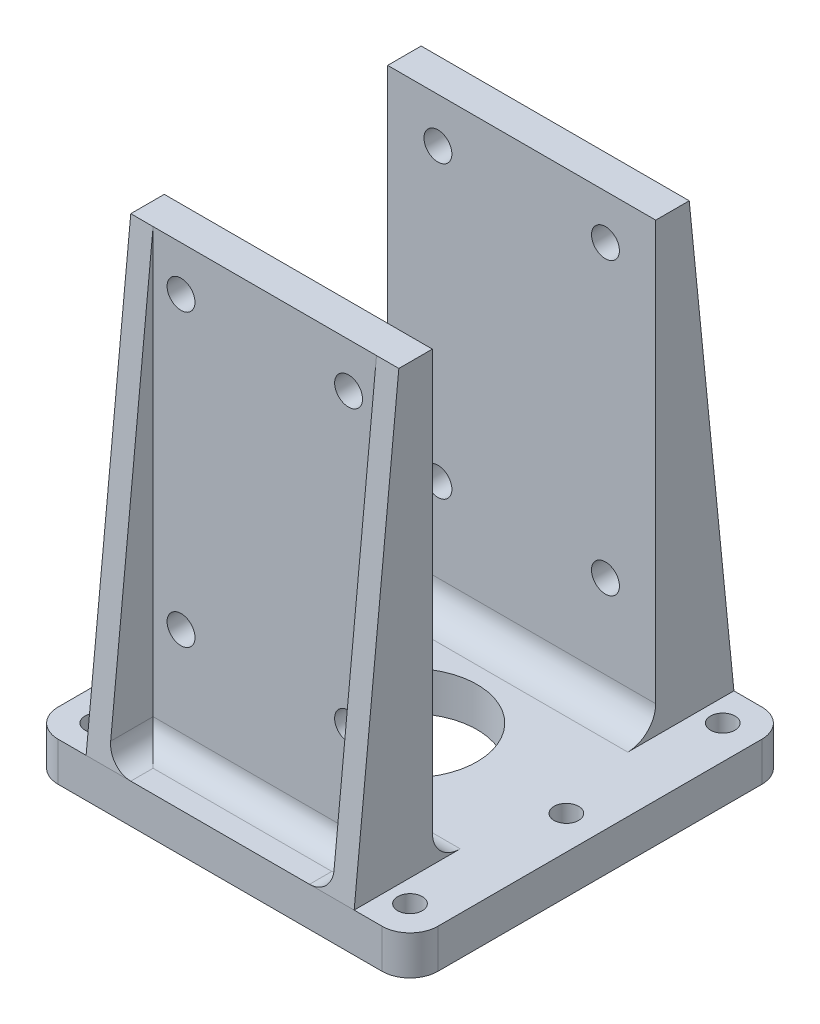
from build123d import *

# Parameters (mm, degrees)
SKETCH1_R           = 2.2
SKETCH1_R_2         = 12
BOSS_EXTRUDE1_DEPTH = 7
SKETCH2_W           = 48
SKETCH2_H           = 6
BOSS_EXTRUDE2_DEPTH = 80
BOSS_EXTRUDE3_DEPTH = 48
SKETCH5_W           = 40
SKETCH5_H           = 8
CUT_EXTRUDE1_DEPTH  = 80
SKETCH6_R           = 2.5
CUT_EXTRUDE2_DEPTH  = 80
FILLET1_R           = 5
FILLET5_R           = 4


with BuildPart() as part:
    # Sketch1 → Boss-Extrude1 (new body)
    with BuildSketch(Plane(origin=(0, 0, 0), x_dir=(1, 0, 0), z_dir=(0, 1, 0))):
        with BuildLine():
            Line((5, 0), (63, 0))
            ThreePointArc((63, 0), (66.535533906, 1.464466094), (68, 5))
            Line((68, 5), (68, 63))
            ThreePointArc((68, 63), (66.535533906, 66.535533906), (63, 68))
            Line((63, 68), (5, 68))
            ThreePointArc((5, 68), (1.464466094, 66.535533906), (0, 63))
            Line((0, 63), (0, 5))
            ThreePointArc((0, 5), (1.464466094, 1.464466094), (5, 0))
        make_face()
        with Locations(Location((6, 6, 0), (0, 0, 270))):
            Circle(SKETCH1_R, mode=Mode.SUBTRACT)
        with Locations(Location((62, 6, 0), (0, 0, 270))):
            Circle(SKETCH1_R, mode=Mode.SUBTRACT)
        with Locations(Location((62, 34, 0), (0, 0, 270))):
            Circle(SKETCH1_R, mode=Mode.SUBTRACT)
        with Locations(Location((62, 62, 0), (0, 0, 270))):
            Circle(SKETCH1_R, mode=Mode.SUBTRACT)
        with Locations(Location((6, 34, 0), (0, 0, 270))):
            Circle(SKETCH1_R, mode=Mode.SUBTRACT)
        with Locations(Location((6, 62, 0), (0, 0, 270))):
            Circle(SKETCH1_R, mode=Mode.SUBTRACT)
        with Locations(Location((34, 34, 0), (0, 0, 270))):
            Circle(SKETCH1_R_2, mode=Mode.SUBTRACT)
    extrude(amount=BOSS_EXTRUDE1_DEPTH)

    # Sketch2 → Boss-Extrude2 (add)
    with BuildSketch(Plane(origin=(0, 7, 0), x_dir=(1, 0, 0), z_dir=(0, 1, 0))):
        with Locations((34, 57)):
            Rectangle(SKETCH2_W, SKETCH2_H)
        with Locations((34, 11)):
            Rectangle(SKETCH2_W, SKETCH2_H)
    extrude(amount=BOSS_EXTRUDE2_DEPTH)

    # Sketch4 → Boss-Extrude3 (add)
    with BuildSketch(Plane(origin=(58, 0, 0), x_dir=(0, 0, -1), z_dir=(1, 0, 0))):
        Polygon((8, 7), (0, 7), (8, 87), align=None)
        Polygon((60, 7), (60, 87), (68, 7), align=None)
    extrude(amount=-BOSS_EXTRUDE3_DEPTH)

    # Sketch5 → Cut-Extrude1 (cut)
    with BuildSketch(Plane(origin=(0, 87, 0), x_dir=(1, 0, 0), z_dir=(0, 1, 0))):
        with Locations((34, 64)):
            Rectangle(SKETCH5_W, SKETCH5_H)
        with Locations((34, 4)):
            Rectangle(SKETCH5_W, SKETCH5_H)
    extrude(amount=-CUT_EXTRUDE1_DEPTH, mode=Mode.SUBTRACT)

    # Sketch6 → Cut-Extrude2 (cut)
    with BuildSketch(Plane.XY.offset(-8)):
        with Locations((19, 79)):
            Circle(SKETCH6_R)
        with Locations((49, 79)):
            Circle(SKETCH6_R)
        with Locations((19, 27)):
            Circle(SKETCH6_R)
        with Locations((49, 27)):
            Circle(SKETCH6_R)
    extrude(amount=-CUT_EXTRUDE2_DEPTH, mode=Mode.SUBTRACT)

    # Fillet1
    fillet1_edges = [part.edges().sort_by_distance(p)[0] for p in [
        (34, 7, -54),
        (34, 7, -14),
    ]]
    fillet(fillet1_edges, radius=FILLET1_R)

    # Fillet5
    fillet5_edges = [part.edges().sort_by_distance(p)[0] for p in [
        (14, 7, -64),
        (54, 7, -64),
        (34, 7, -60),
        (14, 7, -4),
        (34, 7, -8),
        (54, 7, -4),
    ]]
    fillet(fillet5_edges, radius=FILLET5_R)


solid = part.part
